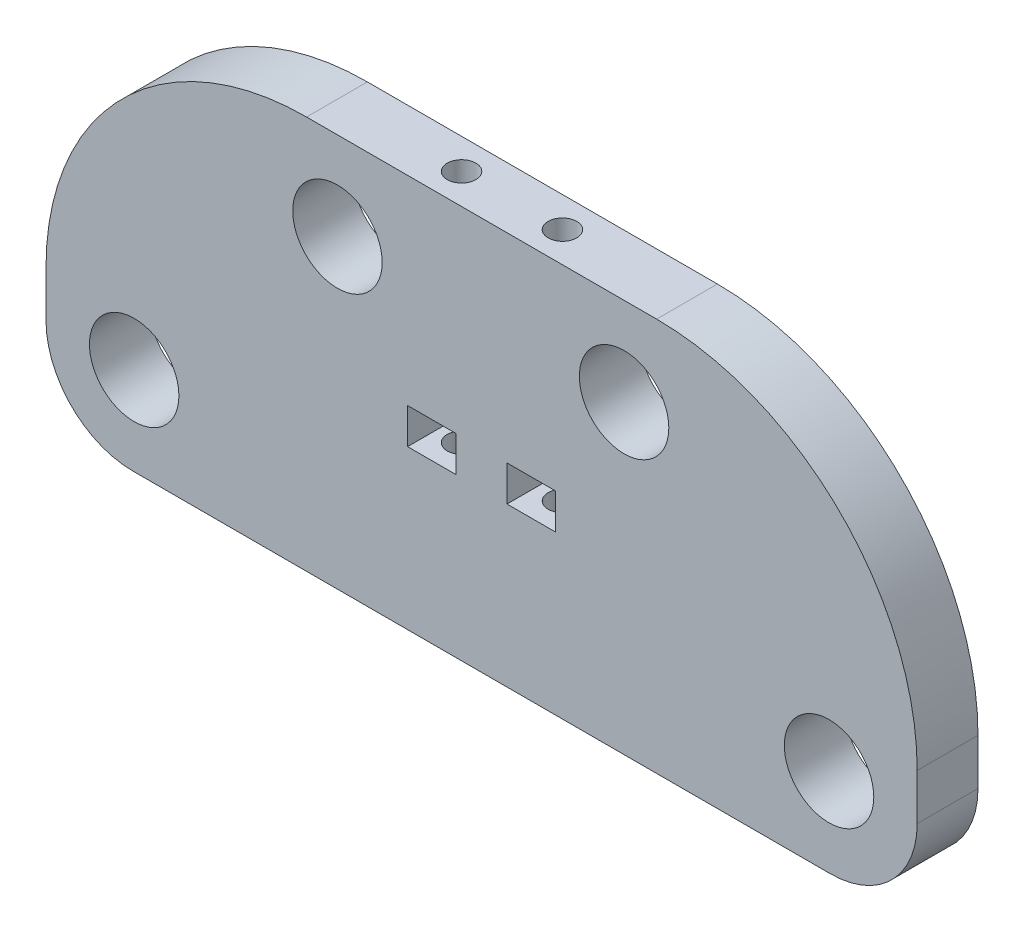
from build123d import *

# Parameters (mm, degrees)
ESBO_O1_W                = 100.3
ESBO_O1_H                = 45.3
ESBO_O1_R                = 5.15
ESBO_O1_W_2              = 5.6
ESBO_O1_H_2              = 4.1
RESSALTO_EXTRUS_O1_DEPTH = 7
ESBO_O2_R                = 1.65
CORTE_EXTRUS_O1_DEPTH    = 35
FILETE1_R                = 10
FILETE2_R                = 30


with BuildPart() as part:
    # Esboço1 → Ressalto-extrusão1 (new body)
    with BuildSketch(Plane.XY):
        with Locations((0.087398189, -8.941132561)):
            Rectangle(ESBO_O1_W, ESBO_O1_H)
        with Locations((-16.508590221, 3.558867439)):
            Circle(ESBO_O1_R, mode=Mode.SUBTRACT)
        with Locations((16.491409779, 3.558867439)):
            Circle(ESBO_O1_R, mode=Mode.SUBTRACT)
        with Locations((-39.912601811, -21.441132561)):
            Circle(ESBO_O1_R, mode=Mode.SUBTRACT)
        with Locations((40.087398189, -21.441132561)):
            Circle(ESBO_O1_R, mode=Mode.SUBTRACT)
        with Locations((-5.635596016, -11.291132561)):
            Rectangle(ESBO_O1_W_2, ESBO_O1_H_2, mode=Mode.SUBTRACT)
        with Locations((5.810392394, -11.291132561)):
            Rectangle(ESBO_O1_W_2, ESBO_O1_H_2, mode=Mode.SUBTRACT)
    extrude(amount=RESSALTO_EXTRUS_O1_DEPTH)

    # Esboço2 → Corte-extrusão1 (cut)
    with BuildSketch(Plane(origin=(0, 13.708867439, 0), x_dir=(1, 0, 0), z_dir=(0, 1, 0))):
        with Locations(Location((-5.722601811, -3.5, 0), (0, 0, 180))):
            Circle(ESBO_O2_R)
        with Locations(Location((5.897398189, -3.5, 0), (0, 0, 270))):
            Circle(ESBO_O2_R)
    extrude(amount=-CORTE_EXTRUS_O1_DEPTH, mode=Mode.SUBTRACT)

    # Filete1
    filete1_edges = [part.edges().sort_by_distance(p)[0] for p in [
        (50.237398189, -31.591132561, 3.5),
        (-50.062601811, -31.591132561, 3.5),
    ]]
    fillet(filete1_edges, radius=FILETE1_R)

    # Filete2
    filete2_edges = [part.edges().sort_by_distance(p)[0] for p in [
        (-50.062601811, 13.708867439, 3.5),
        (50.237398189, 13.708867439, 3.5),
    ]]
    fillet(filete2_edges, radius=FILETE2_R)


solid = part.part
